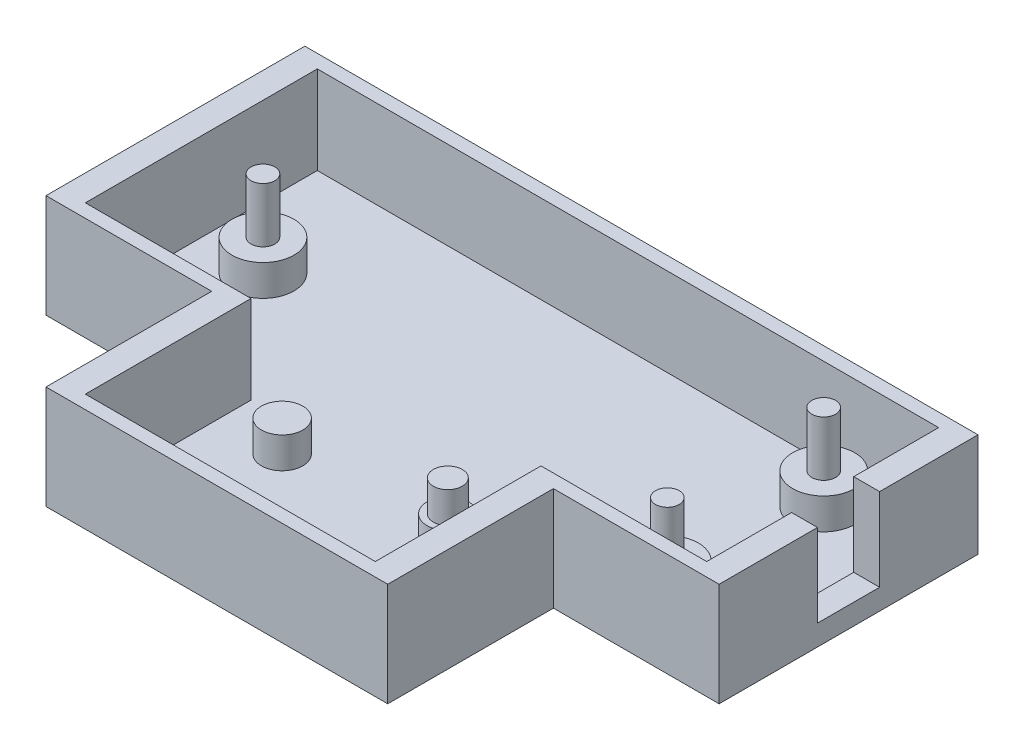
from build123d import *

# Parameters (mm, degrees)
CROQUIS1_W              = 65
CROQUIS1_H              = 25
SALIENTE_EXTRUIR1_DEPTH = 10
CROQUIS2_W              = 60
CROQUIS2_H              = 22.4
CORTAR_EXTRUIR1_DEPTH   = 8.5
SKETCH3_R               = 3
BOSS_EXTRUDE3_DEPTH     = 3
SKETCH4_R               = 1.15
BOSS_EXTRUDE4_DEPTH     = 5.3
CORTAR_EXTRUIR3_REACH   = 68.942
CROQUIS5_W              = 6
CROQUIS5_H              = 8
CROQUIS12_W             = 33
CROQUIS12_H             = 16
SALIENTE_EXTRUIR7_DEPTH = 10
CROQUIS13_W             = 28
CROQUIS13_H             = 16
CORTAR_EXTRUIR6_DEPTH   = 8.5
CROQUIS14_R             = 2
SALIENTE_EXTRUIR8_DEPTH = 3
CROQUIS15_R             = 1.4
SALIENTE_EXTRUIR9_DEPTH = 3


with BuildPart() as part:
    # Croquis1 → Saliente-Extruir1 (new body)
    with BuildSketch(Plane(origin=(0, 0, 0), x_dir=(1, 0, 0), z_dir=(0, 1, 0))):
        Rectangle(CROQUIS1_W, CROQUIS1_H)
    extrude(amount=SALIENTE_EXTRUIR1_DEPTH)

    # Croquis2 → Cortar-Extruir1 (cut)
    with BuildSketch(Plane(origin=(0, 10, 0), x_dir=(1, 0, 0), z_dir=(0, 1, 0))):
        Rectangle(CROQUIS2_W, CROQUIS2_H)
    extrude(amount=-CORTAR_EXTRUIR1_DEPTH, mode=Mode.SUBTRACT)

    # Sketch3 → Boss-Extrude3 (add)
    with BuildSketch(Plane(origin=(0, 1.5, 0), x_dir=(1, 0, 0), z_dir=(0, 1, 0))):
        with Locations(Location((-24.05, 0, 0), (0, 0, 270))):
            Circle(SKETCH3_R)
        with Locations(Location((22.55, 7.55, 0), (0, 0, 270))):
            Circle(SKETCH3_R)
        with Locations(Location((22.55, -7.55, 0), (0, 0, 90))):
            Circle(SKETCH3_R)
    extrude(amount=BOSS_EXTRUDE3_DEPTH)

    # Sketch4 → Boss-Extrude4 (add)
    with BuildSketch(Plane(origin=(0, 4.5, 0), x_dir=(1, 0, 0), z_dir=(0, 1, 0))):
        with Locations(Location((-24.05, 0, 0), (0, 0, 270))):
            Circle(SKETCH4_R)
        with Locations(Location((22.55, 7.55, 0), (0, 0, 270))):
            Circle(SKETCH4_R)
        with Locations(Location((22.55, -7.55, 0), (0, 0, 270))):
            Circle(SKETCH4_R)
    extrude(amount=BOSS_EXTRUDE4_DEPTH)

    # Croquis5 → Cortar-Extruir3 (cut, up to next)
    with BuildSketch(Plane(origin=(32.5, 0, 0), x_dir=(0, 0, -1), z_dir=(1, 0, 0)), mode=Mode.PRIVATE) as cortar_extruir3_sk1:
        with Locations((0, 6)):
            Rectangle(CROQUIS5_W, CROQUIS5_H)
    cortar_extruir3_tool1 = extrude(cortar_extruir3_sk1.sketch, amount=-CORTAR_EXTRUIR3_REACH, mode=Mode.PRIVATE) & part.part
    add(cortar_extruir3_tool1.solids().sort_by_distance((32.5, 6, 0))[0], mode=Mode.SUBTRACT)

    # Croquis12 → Saliente-Extruir7 (add)
    with BuildSketch(Plane(origin=(0, 0, 0), x_dir=(1, 0, 0), z_dir=(0, 1, 0))):
        with Locations((0, -20.5)):
            Rectangle(CROQUIS12_W, CROQUIS12_H)
    extrude(amount=SALIENTE_EXTRUIR7_DEPTH)

    # Croquis13 → Cortar-Extruir6 (cut)
    with BuildSketch(Plane(origin=(0, 10, 0), x_dir=(1, 0, 0), z_dir=(0, 1, 0))):
        with Locations((0, -19.2)):
            Rectangle(CROQUIS13_W, CROQUIS13_H)
    extrude(amount=-CORTAR_EXTRUIR6_DEPTH, mode=Mode.SUBTRACT)

    # Croquis14 → Saliente-Extruir8 (add)
    with BuildSketch(Plane(origin=(0, 1.5, 0), x_dir=(1, 0, 0), z_dir=(0, 1, 0))):
        with Locations(Location((8, -14.2, 0), (0, 0, 270))):
            Circle(CROQUIS14_R)
        with Locations(Location((8, -24.2, 0), (0, 0, 90))):
            Circle(CROQUIS14_R)
        with Locations(Location((-8, -24.2, 0), (0, 0, 270))):
            Circle(CROQUIS14_R)
        with Locations(Location((-8, -14.2, 0), (0, 0, 90))):
            Circle(CROQUIS14_R)
    extrude(amount=SALIENTE_EXTRUIR8_DEPTH)

    # Croquis15 → Saliente-Extruir9 (add)
    with BuildSketch(Plane(origin=(0, 4.5, 0), x_dir=(1, 0, 0), z_dir=(0, 1, 0))):
        with Locations(Location((8, -14.2, 0), (0, 0, 270))):
            Circle(CROQUIS15_R)
    extrude(amount=SALIENTE_EXTRUIR9_DEPTH)


solid = part.part
